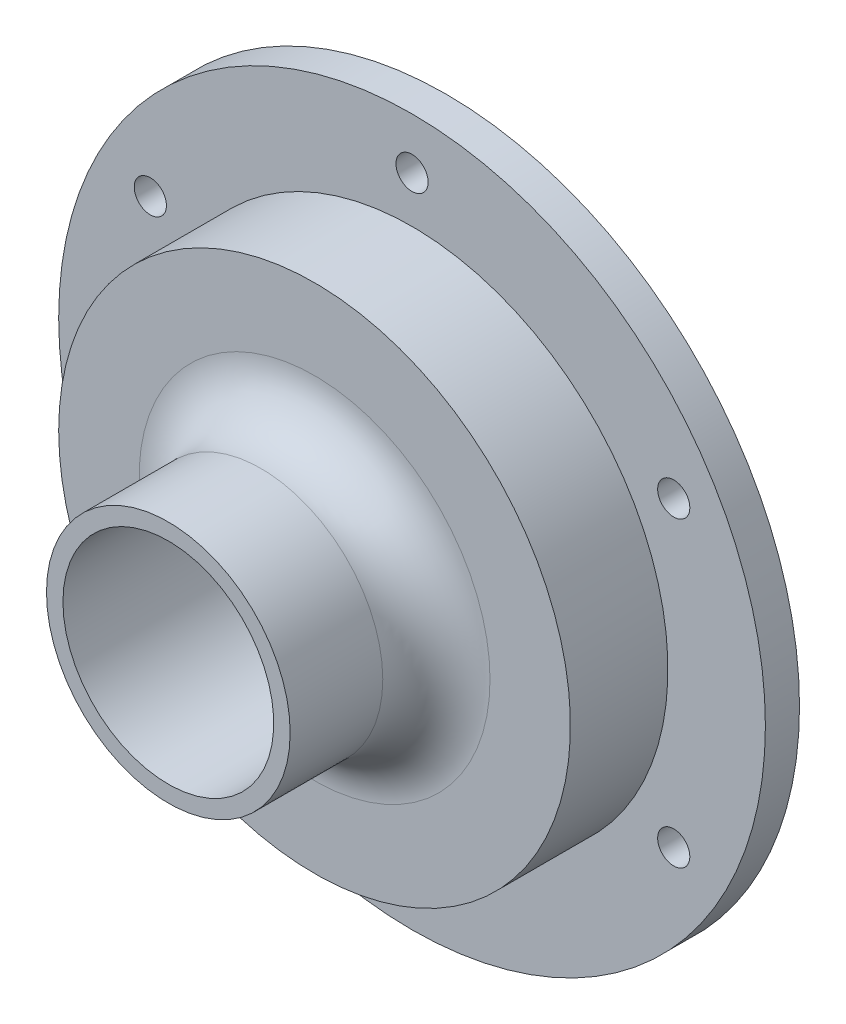
from build123d import *

# Parameters (mm, degrees)
FILLET1_R                               = 11
CBORE_FOR_M6_HEX_HEAD_BOLT1_D           = 6.6
CBORE_FOR_M6_HEX_HEAD_BOLT1_CBORE_D     = 14.547
CBORE_FOR_M6_HEX_HEAD_BOLT1_CBORE_DEPTH = 1
CIRPATTERN1_COUNT                       = 6


with BuildPart() as part:
    # Sketch2 → Revolve1 (revolve)
    with BuildSketch(Plane(origin=(0, 0, 0), x_dir=(1, 0, 0), z_dir=(0, 1, 0))):
        Polygon((-72.5, 0), (-72.5, -7), (-52.5, -7), (-52.5, -27), (-25, -27), (-25, -57), (-21.625, -57), (-21.625, 0), align=None)
    revolve(axis=Axis((0, 0, 0), (0, 0, 1)))

    # Fillet1
    fillet1_edges = [part.edges().sort_by_distance(p)[0] for p in [
        (25, 0, 27),
    ]]
    fillet(fillet1_edges, radius=FILLET1_R)

    # CBORE for M6 Hex Head Bolt1 (through all)
    with Locations(Plane(origin=(0, 0, 0), x_dir=(-1, 0, 0), z_dir=(0, 0, -1))):
        with Locations((0, 62)):
            cbore_for_m6_hex_head_bolt1 = CounterBoreHole(CBORE_FOR_M6_HEX_HEAD_BOLT1_D / 2, CBORE_FOR_M6_HEX_HEAD_BOLT1_CBORE_D / 2, CBORE_FOR_M6_HEX_HEAD_BOLT1_CBORE_DEPTH)

    # CirPattern1: CBORE for M6 Hex Head Bolt1 ×6 about axis
    cirpattern1_axis = Axis((0, 0, 0), (0, 0, 1))
    for i in range(1, CIRPATTERN1_COUNT):
        add(cbore_for_m6_hex_head_bolt1.rotate(cirpattern1_axis, i * 360 / CIRPATTERN1_COUNT), mode=Mode.SUBTRACT)


solid = part.part
